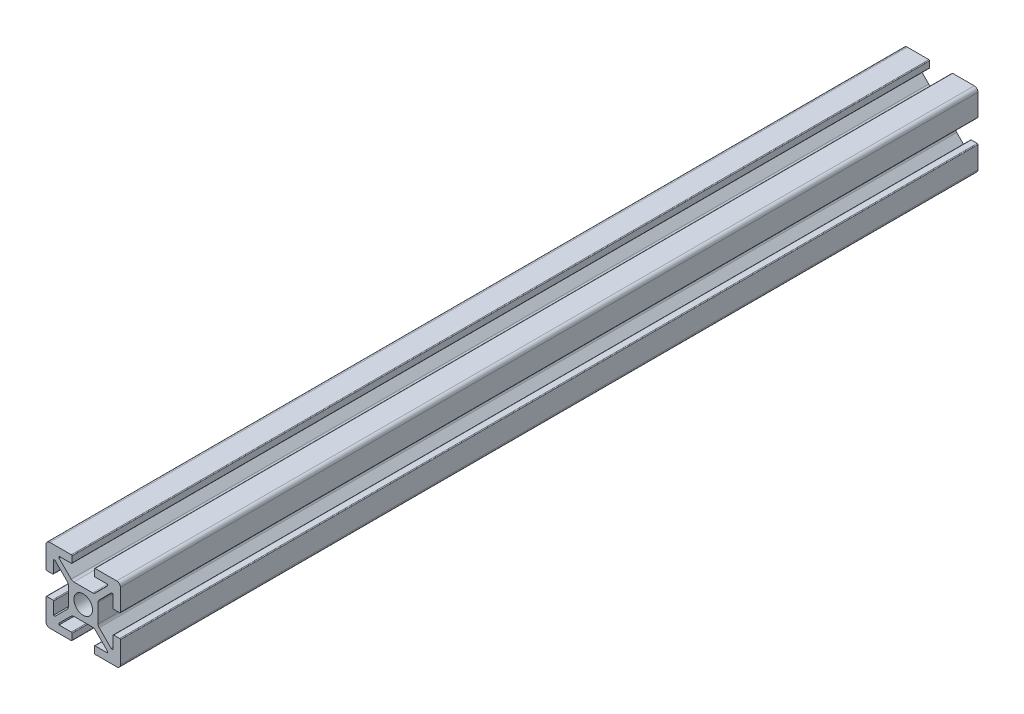
from build123d import *

# Parameters (mm, degrees)
SKETCH1_R           = 2.5
BOSS_EXTRUDE1_DEPTH = 230.5


with BuildPart() as part:
    # Sketch1 → Boss-Extrude1 (new body)
    with BuildSketch(Plane.XY):
        with BuildLine():
            Line((0.2, 13), (1.8, 13))
            ThreePointArc((1.8, 13), (1.941421356, 13.058578644), (2, 13.2))
            Line((2, 13.2), (2, 16.5))
            Line((2, 16.5), (2.439339828, 16.5))
            Line((2.439339828, 16.5), (5.707106781, 13.232233047))
            ThreePointArc((5.707106781, 13.232233047), (5.923879533, 12.907809698), (6, 12.525126266))
            Line((6, 12.525126266), (6, 7.474873734))
            ThreePointArc((6, 7.474873734), (5.923879533, 7.092190302), (5.707106781, 6.767766953))
            Line((5.707106781, 6.767766953), (2.439339828, 3.5))
            Line((2.439339828, 3.5), (2, 3.5))
            Line((2, 3.5), (2, 6.8))
            ThreePointArc((2, 6.8), (1.941421356, 6.941421356), (1.8, 7))
            Line((1.8, 7), (0.2, 7))
            ThreePointArc((0.2, 7), (0.058578644, 6.941421356), (0, 6.8))
            Line((0, 6.8), (0, 1))
            ThreePointArc((0, 1), (0.292893219, 0.292893219), (1, 0))
            Line((1, 0), (6.8, 0))
            ThreePointArc((6.8, 0), (6.941421356, 0.058578644), (7, 0.2))
            Line((7, 0.2), (7, 1.8))
            ThreePointArc((7, 1.8), (6.941421356, 1.941421356), (6.8, 2))
            Line((6.8, 2), (3.5, 2))
            Line((3.5, 2), (3.5, 2.439339828))
            Line((3.5, 2.439339828), (6.767766953, 5.707106781))
            ThreePointArc((6.767766953, 5.707106781), (7.092190302, 5.923879533), (7.474873734, 6))
            Line((7.474873734, 6), (10, 6))
            Line((10, 6), (12.525126266, 6))
            ThreePointArc((12.525126266, 6), (12.907809698, 5.923879533), (13.232233047, 5.707106781))
            Line((13.232233047, 5.707106781), (16.5, 2.439339828))
            Line((16.5, 2.439339828), (16.5, 2))
            Line((16.5, 2), (13.2, 2))
            ThreePointArc((13.2, 2), (13.058578644, 1.941421356), (13, 1.8))
            Line((13, 1.8), (13, 0.2))
            ThreePointArc((13, 0.2), (13.058578644, 0.058578644), (13.2, 0))
            Line((13.2, 0), (19, 0))
            ThreePointArc((19, 0), (19.707106781, 0.292893219), (20, 1))
            Line((20, 1), (20, 6.8))
            ThreePointArc((20, 6.8), (19.941421356, 6.941421356), (19.8, 7))
            Line((19.8, 7), (18.2, 7))
            ThreePointArc((18.2, 7), (18.058578644, 6.941421356), (18, 6.8))
            Line((18, 6.8), (18, 3.5))
            Line((18, 3.5), (17.560660172, 3.5))
            Line((17.560660172, 3.5), (14.292893219, 6.767766953))
            ThreePointArc((14.292893219, 6.767766953), (14.076120467, 7.092190302), (14, 7.474873734))
            Line((14, 7.474873734), (14, 12.525126266))
            ThreePointArc((14, 12.525126266), (14.076120467, 12.907809698), (14.292893219, 13.232233047))
            Line((14.292893219, 13.232233047), (17.560660172, 16.5))
            Line((17.560660172, 16.5), (18, 16.5))
            Line((18, 16.5), (18, 13.2))
            ThreePointArc((18, 13.2), (18.058578644, 13.058578644), (18.2, 13))
            Line((18.2, 13), (19.8, 13))
            ThreePointArc((19.8, 13), (19.941421356, 13.058578644), (20, 13.2))
            Line((20, 13.2), (20, 19))
            ThreePointArc((20, 19), (19.707106781, 19.707106781), (19, 20))
            Line((19, 20), (13.2, 20))
            ThreePointArc((13.2, 20), (13.058578644, 19.941421356), (13, 19.8))
            Line((13, 19.8), (13, 18.2))
            ThreePointArc((13, 18.2), (13.058578644, 18.058578644), (13.2, 18))
            Line((13.2, 18), (16.5, 18))
            Line((16.5, 18), (16.5, 17.560660172))
            Line((16.5, 17.560660172), (13.232233047, 14.292893219))
            ThreePointArc((13.232233047, 14.292893219), (12.907809698, 14.076120467), (12.525126266, 14))
            Line((12.525126266, 14), (10, 14))
            Line((10, 14), (7.474873734, 14))
            ThreePointArc((7.474873734, 14), (7.092190302, 14.076120467), (6.767766953, 14.292893219))
            Line((6.767766953, 14.292893219), (3.5, 17.560660172))
            Line((3.5, 17.560660172), (3.5, 18))
            Line((3.5, 18), (6.8, 18))
            ThreePointArc((6.8, 18), (6.941421356, 18.058578644), (7, 18.2))
            Line((7, 18.2), (7, 19.8))
            ThreePointArc((7, 19.8), (6.941421356, 19.941421356), (6.8, 20))
            Line((6.8, 20), (1, 20))
            ThreePointArc((1, 20), (0.292893219, 19.707106781), (0, 19))
            Line((0, 19), (0, 13.2))
            ThreePointArc((0, 13.2), (0.058578644, 13.058578644), (0.2, 13))
        make_face()
        with Locations((10, 10)):
            Circle(SKETCH1_R, mode=Mode.SUBTRACT)
    extrude(amount=BOSS_EXTRUDE1_DEPTH)


solid = part.part
